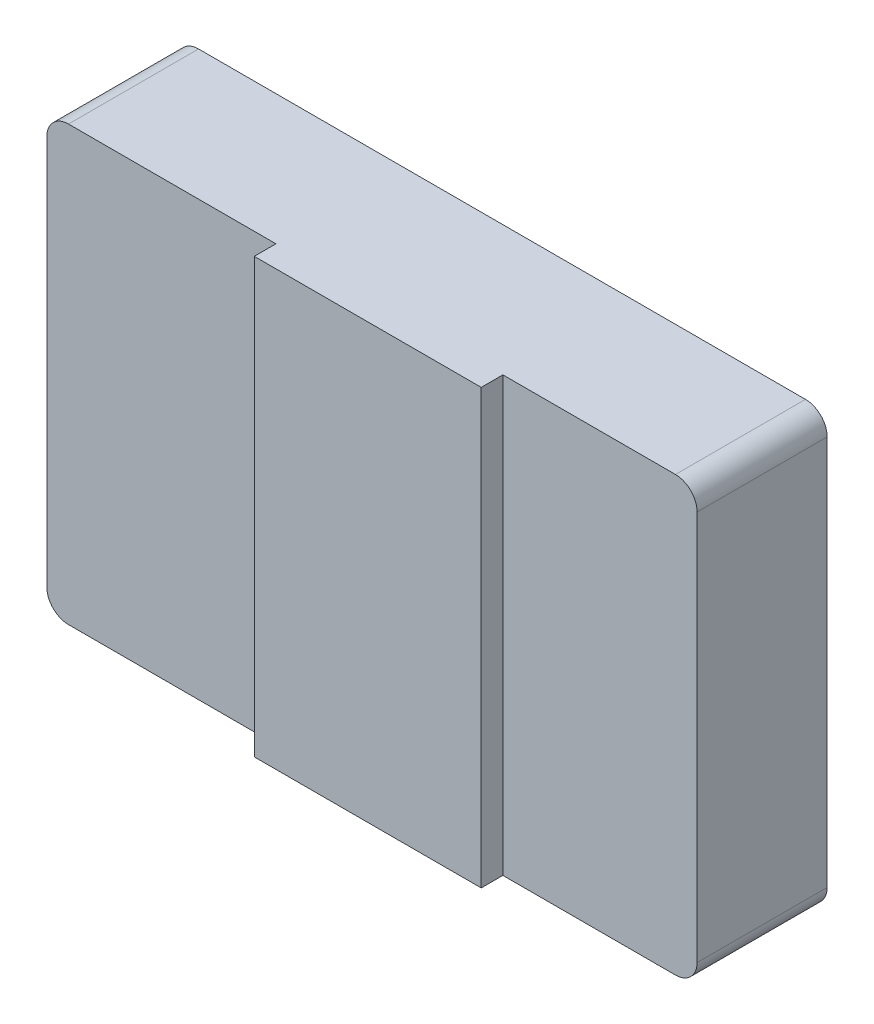
from build123d import *

# Parameters (mm, degrees)
SKETCH_1_W           = 3
SKETCH_1_H           = 2
EXTRUDE_1_DEPTH      = 0.7
SKETCH_2_OUTSIDE_W   = 5.734
SKETCH_2_OUTSIDE_H   = 4.734
SKETCH_2_OUTSIDE_W_2 = 1.047048505
SKETCH_2_OUTSIDE_H_2 = 2
CUT_EXTRUDE_1_DEPTH  = 0.1
FILLET_1_R           = 0.1


with BuildPart() as part:
    # 草图1 → 凸台-拉伸1 (new body)
    with BuildSketch(Plane.XY):
        with Locations((1.5, 1)):
            Rectangle(SKETCH_1_W, SKETCH_1_H)
    extrude(amount=EXTRUDE_1_DEPTH)

    # 草图2 outside → 切除-拉伸1 (cut)
    with BuildSketch(Plane.XY.offset(0.7)):
        with Locations((1.5, 1)):
            Rectangle(SKETCH_2_OUTSIDE_W, SKETCH_2_OUTSIDE_H)
        with Locations((1.580478371, 1)):
            Rectangle(SKETCH_2_OUTSIDE_W_2, SKETCH_2_OUTSIDE_H_2, mode=Mode.SUBTRACT)
    extrude(amount=-CUT_EXTRUDE_1_DEPTH, mode=Mode.SUBTRACT)

    # 圆角1
    fillet_1_edges = [part.edges().sort_by_distance(p)[0] for p in [
        (0, 2, 0.3),
        (3, 2, 0.3),
        (3, 0, 0.3),
        (0, 0, 0.3),
    ]]
    fillet(fillet_1_edges, radius=FILLET_1_R)


solid = part.part
